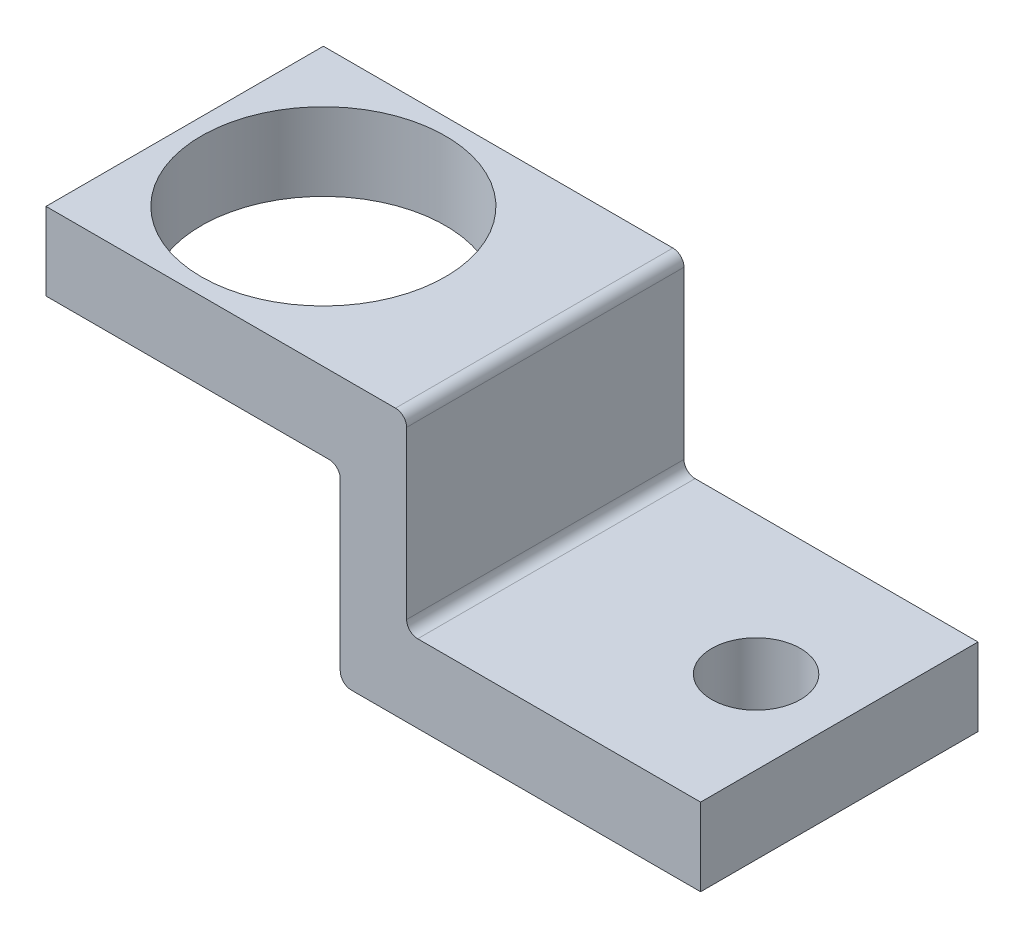
from build123d import *

# Parameters (mm, degrees)
BOSS_EXTRUDE1_DEPTH = 25
SKETCH3_R           = 11
CUT_EXTRUDE1_DEPTH  = 69.425214496
SKETCH4_R           = 4
CUT_EXTRUDE2_DEPTH  = 67.294871437


with BuildPart() as part:
    # Sketch2 → Boss-Extrude1 (new body)
    with BuildSketch(Plane.XY):
        with BuildLine():
            Line((0, 0), (0, 7))
            Line((0, 7), (31.5, 7))
            ThreePointArc((31.5, 7), (32.207106781, 6.707106781), (32.5, 6))
            Line((32.5, 6), (32.5, -9))
            ThreePointArc((32.5, -9), (32.792893219, -9.707106781), (33.5, -10))
            Line((33.5, -10), (59.000084567, -10))
            Line((59.000084567, -10), (59.000084567, -17))
            Line((59.000084567, -17), (27.520084567, -17))
            ThreePointArc((27.520084567, -17), (26.812977785, -16.707106781), (26.520084567, -16))
            Line((26.520084567, -16), (26.520084567, -1))
            ThreePointArc((26.520084567, -1), (26.227191348, -0.292893219), (25.520084567, 0))
            Line((25.520084567, 0), (0, 0))
        make_face()
    extrude(amount=BOSS_EXTRUDE1_DEPTH)

    # Sketch3 → Cut-Extrude1 (cut, through all)
    with BuildSketch(Plane(origin=(0, 7, 0), x_dir=(1, 0, 0), z_dir=(0, 1, 0))):
        with Locations(Location((12.5, -12.5, 0), (0, 0, 270))):
            Circle(SKETCH3_R)
    extrude(amount=-CUT_EXTRUDE1_DEPTH, mode=Mode.SUBTRACT)

    # Sketch4 → Cut-Extrude2 (cut, through all)
    with BuildSketch(Plane(origin=(0, -10, 0), x_dir=(1, 0, 0), z_dir=(0, 1, 0))):
        with Locations(Location((51.500084567, -12.5, 0), (0, 0, 270))):
            Circle(SKETCH4_R)
    extrude(amount=-CUT_EXTRUDE2_DEPTH, mode=Mode.SUBTRACT)


solid = part.part
